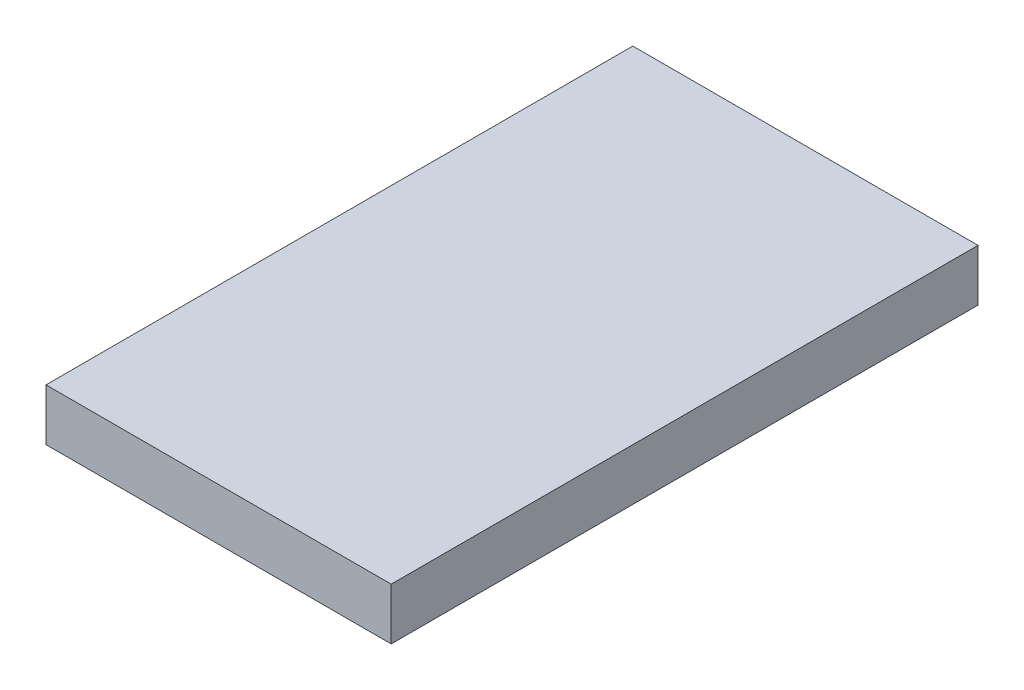
from build123d import *

# Parameters (mm, degrees)
SKETCH1_W           = 20
SKETCH1_H           = 34
BOSS_EXTRUDE1_DEPTH = 3


with BuildPart() as part:
    # Sketch1 → Boss-Extrude1 (new body)
    with BuildSketch(Plane(origin=(0, 0, 0), x_dir=(1, 0, 0), z_dir=(0, 1, 0))):
        Rectangle(SKETCH1_W, SKETCH1_H)
    extrude(amount=BOSS_EXTRUDE1_DEPTH)


solid = part.part
